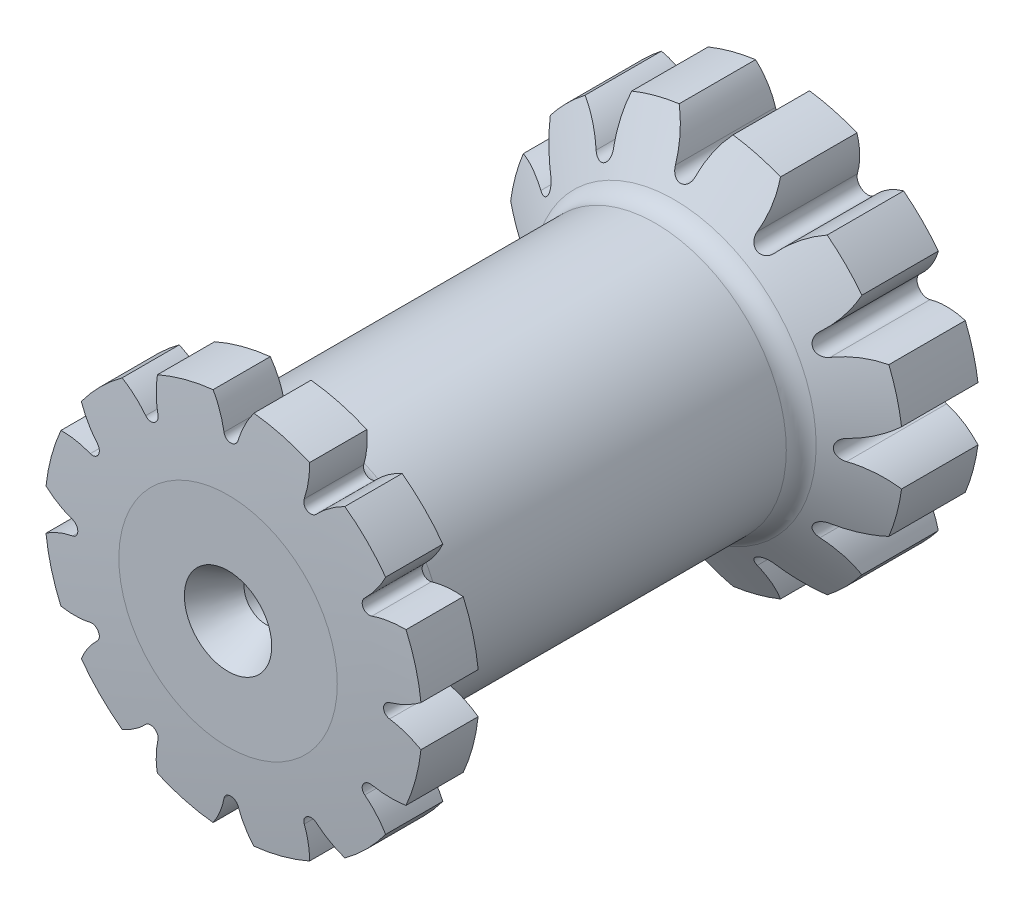
from build123d import *

# Parameters (mm, degrees)
CUT_EXTRUDE1_REACH = 46.353
CIRPATTERN1_COUNT  = 12
CUT_EXTRUDE2_START = -4.3
CUT_EXTRUDE2_DEPTH = 4.3
CIRPATTERN2_COUNT  = 12


with BuildPart() as part:
    # Sketch1 → Revolve1 (revolve)
    with BuildSketch(Plane(origin=(0, 0, 0), x_dir=(0, 0, -1), z_dir=(1, 0, 0)), mode=Mode.PRIVATE) as revolve1_sk:
        with BuildLine():
            Line((0.372436534, 12.95), (4.3, 12.95))
            Line((4.3, 12.95), (4.3, 10.5))
            ThreePointArc((4.3, 10.5), (4.739339828, 9.439339828), (5.8, 9))
            Line((5.8, 9), (29.333974596, 9))
            ThreePointArc((29.333974596, 9), (30.083974596, 9.200961894), (30.633012702, 9.75))
            Line((30.633012702, 9.75), (32.826943725, 13.55))
            Line((32.826943725, 13.55), (38.074355367, 13.55))
            ThreePointArc((38.074355367, 13.55), (38.317758287, 10.527151483), (38.5, 7.5))
            Line((38.5, 7.5), (38.5, 0))
            Line((38.5, 0), (0, 0))
            Line((0, 0), (0, 7.5))
            ThreePointArc((0, 7.5), (0.161406398, 10.226695568), (0.372436534, 12.95))
        make_face()
    revolve(revolve1_sk.sketch.rotate(Axis((0, 0, 0), (0, 0, -1)), 90), axis=Axis((0, 0, 0), (0, 0, -1)))

    # Sketch2 → Cut-Revolve1 (revolve, cut)
    with BuildSketch(Plane(origin=(0, 0, 0), x_dir=(0, 0, -1), z_dir=(1, 0, 0))):
        Polygon((38.5, 3), (35.901923789, 1.5), (33.401290929, 1.5), (32.5, 0), (38.5, 0), align=None)
    revolve(axis=Axis((0, 0, 0), (0, 0, -1)), mode=Mode.SUBTRACT)

    # Sketch3 → Cut-Revolve2 (revolve, cut)
    with BuildSketch(Plane(origin=(0, 0, 0), x_dir=(0, 0, -1), z_dir=(1, 0, 0)), mode=Mode.PRIVATE) as cut_revolve2_sk:
        Polygon((0, 3), (2.598076211, 1.5), (5.098709071, 1.5), (6, 0), (0, 0), align=None)
    revolve(cut_revolve2_sk.sketch.rotate(Axis((0, 0, 0), (0, 0, -1)), 90), axis=Axis((0, 0, 0), (0, 0, -1)), mode=Mode.SUBTRACT)

    # Cut-Extrude1: up to this cone (the profile starts inside it)
    cut_extrude1_end = Plane(origin=(0, 0, -40), z_dir=(0, 0, -1)).offset(-14.996151423) * Cone(1.732e-06, 152.114331669, 87.823249337, align=(Align.CENTER, Align.CENTER, Align.MIN), mode=Mode.PRIVATE)
    # Sketch4 → Cut-Extrude1 (cut, up to the surface)
    with BuildSketch(Plane.XY.offset(-40), mode=Mode.PRIVATE) as cut_extrude1_sk1:
        with BuildLine():
            ThreePointArc((-0.687083468, 11.066148185), (0, 10.5), (0.687083468, 11.066148185))
            ThreePointArc((0.687083468, 11.066148185), (1.110903713, 12.32240918), (1.85, 13.423114393))
            ThreePointArc((1.85, 13.423114393), (0, 13.55), (-1.85, 13.423114393))
            ThreePointArc((-1.85, 13.423114393), (-1.110903713, 12.32240918), (-0.687083468, 11.066148185))
        make_face()
    cut_extrude1_tool1 = extrude(cut_extrude1_sk1.sketch, amount=CUT_EXTRUDE1_REACH, mode=Mode.PRIVATE) & cut_extrude1_end
    cut_extrude1 = cut_extrude1_tool1.solids().sort_by_distance((0, 12.343193, -40))[0]
    add(cut_extrude1, mode=Mode.SUBTRACT)

    # CirPattern1: Cut-Extrude1 ×12 about axis
    cirpattern1_axis = Axis((0, 0, 0), (0, 0, 1))
    for i in range(1, CIRPATTERN1_COUNT):
        add(cut_extrude1.rotate(cirpattern1_axis, i * 360 / CIRPATTERN1_COUNT), mode=Mode.SUBTRACT)

    # Sketch5 → Cut-Extrude2 (cut)
    with BuildSketch(Plane.XY.offset(CUT_EXTRUDE2_START)):
        with BuildLine():
            ThreePointArc((1.4, 12.87410191), (0, 12.95), (-1.4, 12.87410191))
            ThreePointArc((-1.4, 12.87410191), (-0.847802037, 11.921233508), (-0.48567289, 10.881164634))
            ThreePointArc((-0.48567289, 10.881164634), (0, 10.5), (0.48567289, 10.881164634))
            ThreePointArc((0.48567289, 10.881164634), (0.847802037, 11.921233508), (1.4, 12.87410191))
        make_face()
    cut_extrude2 = extrude(amount=CUT_EXTRUDE2_DEPTH, mode=Mode.SUBTRACT)

    # CirPattern2: Cut-Extrude2 ×12 about axis
    cirpattern2_axis = Axis((0, 0, 0), (0, 0, 1))
    for i in range(1, CIRPATTERN2_COUNT):
        add(cut_extrude2.rotate(cirpattern2_axis, i * 360 / CIRPATTERN2_COUNT), mode=Mode.SUBTRACT)


solid = part.part
